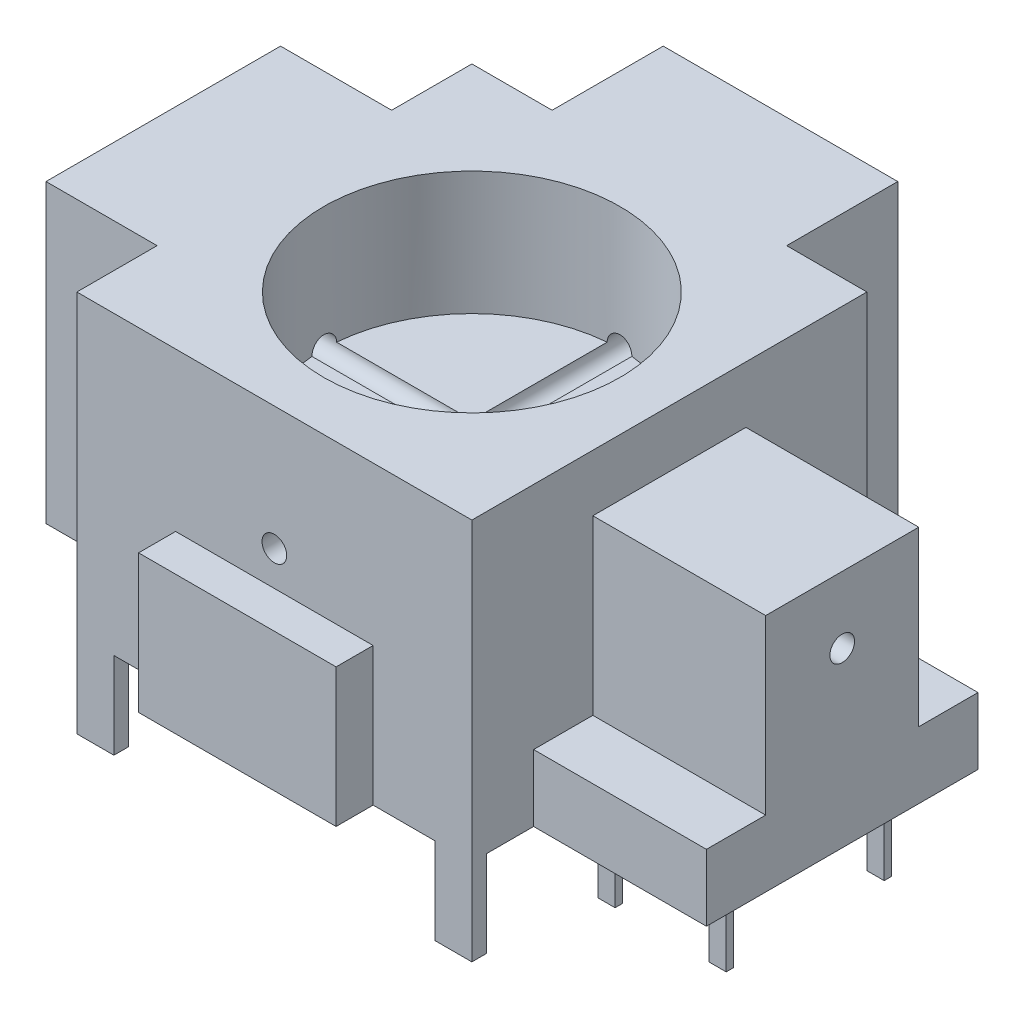
from build123d import *

# Parameters (mm, degrees)
SKETCH1_W               = 16
SKETCH1_H               = 16
BOSS_EXTRUDE1_DEPTH     = 12
SKETCH2_W               = 9.5
SKETCH2_H               = 12
BOSS_EXTRUDE2_DEPTH     = 4.5
CIRPATTERN1_COUNT       = 2
CIRPATTERN1_ANGLE       = 90
SKETCH4_W               = 8
SKETCH4_H               = 5.6
BOSS_EXTRUDE3_DEPTH     = 1.5
SKETCH5_W               = 11
SKETCH5_H               = 2.7
BOSS_EXTRUDE4_DEPTH     = 7
SKETCH6_W               = 7
SKETCH6_H               = 6.2
BOSS_EXTRUDE5_DEPTH     = 7
SKETCH7_R               = 6
CUT_EXTRUDE1_DEPTH      = 5
CUT_EXTRUDE2_DEPTH      = 23.918333273
CUT_EXTRUDE2_DEPTH_BACK = 23.918333273
SKETCH8_R               = 0.5
CUT_EXTRUDE3_DEPTH      = 23.918333391
CUT_EXTRUDE3_DEPTH_BACK = 23.918333391
SKETCH9_R               = 0.5
SKETCH10_W              = 1.5
SKETCH10_H              = 0.6
SKETCH10_W_2            = 0.4
SKETCH10_H_2            = 0.8
SKETCH10_W_3            = 0.8
SKETCH10_H_3            = 0.4
SKETCH10_W_4            = 0.7
SKETCH10_H_4            = 0.3
BOSS_EXTRUDE6_DEPTH     = 3.5


with BuildPart() as part:
    # Sketch1 → Boss-Extrude1 (new body)
    with BuildSketch(Plane(origin=(0, 0, 0), x_dir=(1, 0, 0), z_dir=(0, 1, 0))):
        Rectangle(SKETCH1_W, SKETCH1_H)
    extrude(amount=BOSS_EXTRUDE1_DEPTH)

    # Sketch2 → Boss-Extrude2 (add)
    with BuildSketch(Plane.ZY.offset(8)):
        with Locations((0, 6)):
            Rectangle(SKETCH2_W, SKETCH2_H)
    boss_extrude2 = extrude(amount=BOSS_EXTRUDE2_DEPTH)

    # CirPattern1: Boss-Extrude2 ×2 about axis
    cirpattern1_axis = Axis((0, 12.6, 0), (0, -1, 0))
    for i in range(1, CIRPATTERN1_COUNT):
        add(boss_extrude2.rotate(cirpattern1_axis, i * CIRPATTERN1_ANGLE / (CIRPATTERN1_COUNT - 1)))

    # Sketch4 → Boss-Extrude3 (add)
    with BuildSketch(Plane.XY.offset(8)):
        with Locations((0, 2.8)):
            Rectangle(SKETCH4_W, SKETCH4_H)
    extrude(amount=BOSS_EXTRUDE3_DEPTH)

    # Sketch5 → Boss-Extrude4 (add)
    with BuildSketch(Plane(origin=(8, 0, 0), x_dir=(0, 0, -1), z_dir=(1, 0, 0))):
        with Locations((0, 1.35)):
            Rectangle(SKETCH5_W, SKETCH5_H)
    extrude(amount=BOSS_EXTRUDE4_DEPTH)

    # Sketch6 → Boss-Extrude5 (add)
    with BuildSketch(Plane(origin=(0, 2.7, 0), x_dir=(1, 0, 0), z_dir=(0, 1, 0))):
        with Locations((11.5, 0)):
            Rectangle(SKETCH6_W, SKETCH6_H)
    extrude(amount=BOSS_EXTRUDE5_DEPTH)

    # Sketch7 → Cut-Extrude1 (cut)
    with BuildSketch(Plane(origin=(0, 12, 0), x_dir=(1, 0, 0), z_dir=(0, 1, 0))):
        Circle(SKETCH7_R)
    extrude(amount=-CUT_EXTRUDE1_DEPTH, mode=Mode.SUBTRACT)

    # Sketch8 → Cut-Extrude2 (cut, two sides: drawn at the far end of the back side and taken through both)
    with BuildSketch(Plane(origin=(0, 0, 0), x_dir=(0, 0, -1), z_dir=(1, 0, 0)).offset(-CUT_EXTRUDE2_DEPTH_BACK)):
        with Locations((0, 7)):
            Circle(SKETCH8_R)
    extrude(amount=CUT_EXTRUDE2_DEPTH + CUT_EXTRUDE2_DEPTH_BACK, mode=Mode.SUBTRACT)

    # Sketch9 → Cut-Extrude3 (cut, two sides: drawn at the far end of the back side and taken through both)
    with BuildSketch(Plane.XY.offset(-CUT_EXTRUDE3_DEPTH_BACK)):
        with Locations((0, 7)):
            Circle(SKETCH9_R)
    extrude(amount=CUT_EXTRUDE3_DEPTH + CUT_EXTRUDE3_DEPTH_BACK, mode=Mode.SUBTRACT)

    # Sketch10 → Boss-Extrude6 (add)
    with BuildSketch(Plane.XZ):
        with Locations((7.25, 7.7)):
            Rectangle(SKETCH10_W, SKETCH10_H)
        with Locations((-7.25, 7.7)):
            Rectangle(SKETCH10_W, SKETCH10_H)
        with Locations((7.25, -7.7)):
            Rectangle(SKETCH10_W, SKETCH10_H)
        with Locations((-7.25, -7.7)):
            Rectangle(SKETCH10_W, SKETCH10_H)
        with Locations((-11.3, 0)):
            Rectangle(SKETCH10_W_2, SKETCH10_H_2)
        with Locations((-11.3, -2.5)):
            Rectangle(SKETCH10_W_2, SKETCH10_H_2)
        with Locations((-11.3, 2.5)):
            Rectangle(SKETCH10_W_2, SKETCH10_H_2)
        with Locations((-2.5, -11.3)):
            Rectangle(SKETCH10_W_3, SKETCH10_H_3)
        with Locations((0, -11.3)):
            Rectangle(SKETCH10_W_3, SKETCH10_H_3)
        with Locations((2.5, -11.3)):
            Rectangle(SKETCH10_W_3, SKETCH10_H_3)
        with Locations((13.15, -3.35)):
            Rectangle(SKETCH10_W_4, SKETCH10_H_4)
        with Locations((8.65, -3.35)):
            Rectangle(SKETCH10_W_4, SKETCH10_H_4)
        with Locations((8.65, 3.05)):
            Rectangle(SKETCH10_W_4, SKETCH10_H_4)
        with Locations((13.15, 3.05)):
            Rectangle(SKETCH10_W_4, SKETCH10_H_4)
    extrude(amount=BOSS_EXTRUDE6_DEPTH)


solid = part.part
